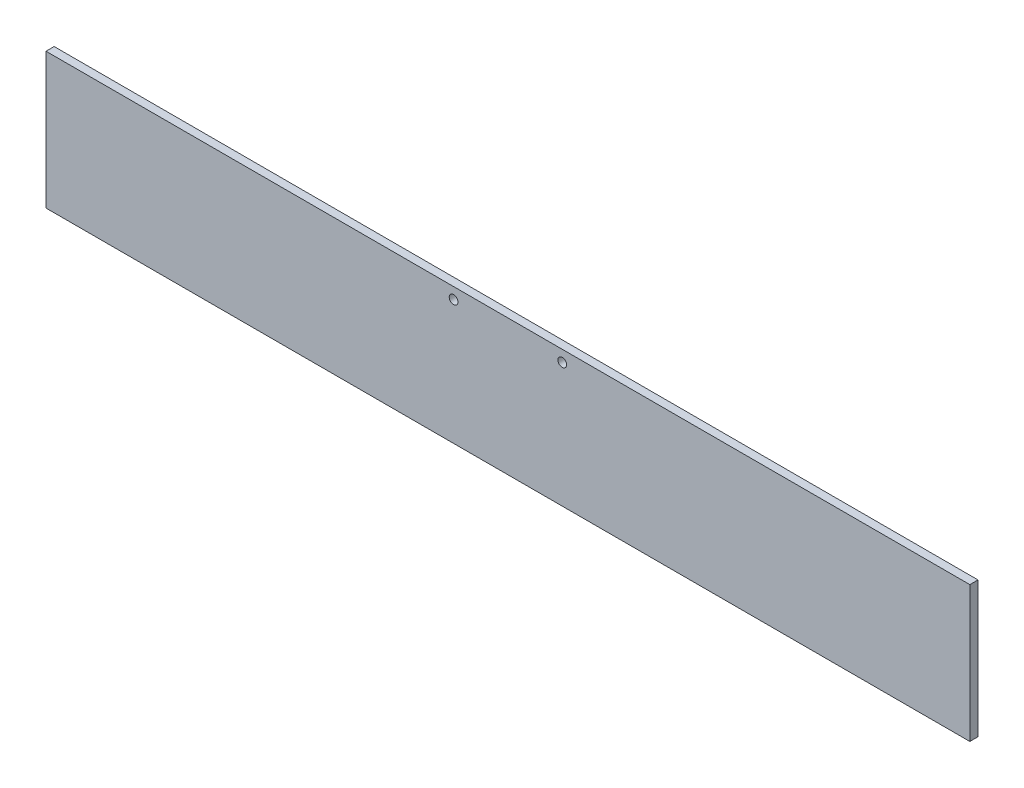
from build123d import *

# Parameters (mm, degrees)
SKETCH1_W           = 340
SKETCH1_H           = 50
BOSS_EXTRUDE1_DEPTH = 3
CUT_EXTRUDE1_REACH  = 345.67
SKETCH2_R           = 1.6


with BuildPart() as part:
    # Sketch1 → Boss-Extrude1 (new body)
    with BuildSketch(Plane.XY):
        with Locations((170, 25)):
            Rectangle(SKETCH1_W, SKETCH1_H)
    extrude(amount=BOSS_EXTRUDE1_DEPTH)

    # Sketch2 → Cut-Extrude1 (cut, up to next)
    with BuildSketch(Plane.XY.offset(3), mode=Mode.PRIVATE) as cut_extrude1_sk1:
        with Locations((150, 45.82699859)):
            Circle(SKETCH2_R)
    cut_extrude1_tool1 = extrude(cut_extrude1_sk1.sketch, amount=-CUT_EXTRUDE1_REACH, mode=Mode.PRIVATE) & part.part
    # Sketch2 → Cut-Extrude1 (cut, up to next)
    with BuildSketch(Plane.XY.offset(3), mode=Mode.PRIVATE) as cut_extrude1_sk2:
        with Locations((190, 45.82699859)):
            Circle(SKETCH2_R)
    cut_extrude1_tool2 = extrude(cut_extrude1_sk2.sketch, amount=-CUT_EXTRUDE1_REACH, mode=Mode.PRIVATE) & part.part
    add(cut_extrude1_tool1.solids().sort_by_distance((150, 45.826999, 3))[0], mode=Mode.SUBTRACT)
    add(cut_extrude1_tool2.solids().sort_by_distance((190, 45.826999, 3))[0], mode=Mode.SUBTRACT)


solid = part.part
